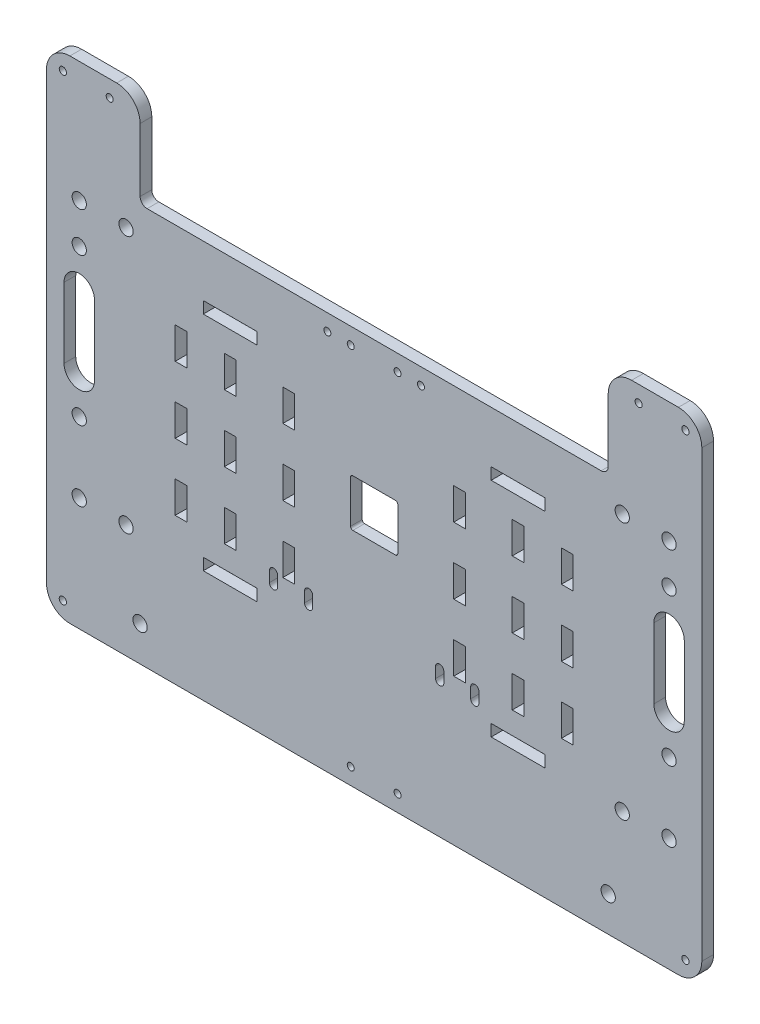
from build123d import *

# Parameters (mm, degrees)
BOSS_EXTRU_1_DEPTH       = 5
ESQUISSE2_W              = 23.01
ESQUISSE2_H              = 5.01
ESQUISSE2_W_2            = 5.01
ESQUISSE2_H_2            = 13.5
ENL_V_MAT_EXTRU_7_DEPTH  = 10
ESQUISSE3_R              = 3.05
ENL_V_MAT_EXTRU_8_DEPTH  = 5
ENL_V_MAT_EXTRU_12_DEPTH = 5
ESQUISSE5_R              = 3.05
ESQUISSE5_R_2            = 1.55
ESQUISSE5_R_3            = 1.5
ENL_V_MAT_EXTRU_13_DEPTH = 5
ENL_V_MAT_EXTRU_14_DEPTH = 5


with BuildPart() as part:
    # Esquisse1 → Boss.-Extru.1 (new body)
    with BuildSketch(Plane.XY):
        with BuildLine():
            Line((130, -105), (-130, -105))
            ThreePointArc((-130, -105), (-137.071067812, -102.071067812), (-140, -95))
            Line((-140, -95), (-140, 105))
            Line((-140, 105), (140, 105))
            Line((140, 105), (140, -95))
            ThreePointArc((140, -95), (137.071067812, -102.071067812), (130, -105))
        make_face()
    extrude(amount=BOSS_EXTRU_1_DEPTH)

    # Esquisse2 → Enlèv. mat.-Extru.7 (cut)
    with BuildSketch(Plane.XY.offset(5)):
        with Locations((-61.505, 40.495)):
            Rectangle(ESQUISSE2_W, ESQUISSE2_H)
        with Locations((-61.505, 21.25)):
            Rectangle(ESQUISSE2_W_2, ESQUISSE2_H_2)
        with Locations((-82.505, 21.25)):
            Rectangle(ESQUISSE2_W_2, ESQUISSE2_H_2)
        with Locations((-82.505, -7.25)):
            Rectangle(ESQUISSE2_W_2, ESQUISSE2_H_2)
        with Locations((-61.505, -7.25)):
            Rectangle(ESQUISSE2_W_2, ESQUISSE2_H_2)
        with Locations((-61.505, -35.75)):
            Rectangle(ESQUISSE2_W_2, ESQUISSE2_H_2)
        with Locations((-82.505, -35.75)):
            Rectangle(ESQUISSE2_W_2, ESQUISSE2_H_2)
        with Locations((-61.505, -54.495)):
            Rectangle(ESQUISSE2_W, ESQUISSE2_H)
        with Locations((-36.505, -35.75)):
            Rectangle(ESQUISSE2_W_2, ESQUISSE2_H_2)
        with Locations((-36.505, 21.25)):
            Rectangle(ESQUISSE2_W_2, ESQUISSE2_H_2)
        with Locations((-36.505, -7.25)):
            Rectangle(ESQUISSE2_W_2, ESQUISSE2_H_2)
        with Locations((36.505, 21.25)):
            Rectangle(ESQUISSE2_W_2, ESQUISSE2_H_2)
        with Locations((61.505, 40.495)):
            Rectangle(ESQUISSE2_W, ESQUISSE2_H)
        with Locations((61.505, 21.25)):
            Rectangle(ESQUISSE2_W_2, ESQUISSE2_H_2)
        with Locations((82.505, 21.25)):
            Rectangle(ESQUISSE2_W_2, ESQUISSE2_H_2)
        with Locations((82.505, -35.75)):
            Rectangle(ESQUISSE2_W_2, ESQUISSE2_H_2)
        with Locations((82.505, -7.25)):
            Rectangle(ESQUISSE2_W_2, ESQUISSE2_H_2)
        with Locations((61.505, -7.25)):
            Rectangle(ESQUISSE2_W_2, ESQUISSE2_H_2)
        with Locations((61.505, -35.75)):
            Rectangle(ESQUISSE2_W_2, ESQUISSE2_H_2)
        with Locations((61.505, -54.495)):
            Rectangle(ESQUISSE2_W, ESQUISSE2_H)
        with Locations((36.505, -35.75)):
            Rectangle(ESQUISSE2_W_2, ESQUISSE2_H_2)
        with Locations((36.505, -7.25)):
            Rectangle(ESQUISSE2_W_2, ESQUISSE2_H_2)
    extrude(amount=-ENL_V_MAT_EXTRU_7_DEPTH, mode=Mode.SUBTRACT)

    # Esquisse3 → Enlèv. mat.-Extru.8 (cut)
    with BuildSketch(Plane.XY.offset(5)):
        with Locations((-126, 36.4987829)):
            Circle(ESQUISSE3_R)
        with Locations((-126, -26.5012171)):
            Circle(ESQUISSE3_R)
        with Locations((-126, 53.4987829)):
            Circle(ESQUISSE3_R)
        with Locations((-126, -56.5012171)):
            Circle(ESQUISSE3_R)
        with Locations((-106, 53.4987829)):
            Circle(ESQUISSE3_R)
        with Locations((-106, -56.5012171)):
            Circle(ESQUISSE3_R)
        with Locations((106, -56.5012171)):
            Circle(ESQUISSE3_R)
        with Locations((106, 53.4987829)):
            Circle(ESQUISSE3_R)
        with Locations((126, -56.5012171)):
            Circle(ESQUISSE3_R)
        with Locations((126, 53.4987829)):
            Circle(ESQUISSE3_R)
        with Locations((126, -26.5012171)):
            Circle(ESQUISSE3_R)
        with Locations((126, 36.4987829)):
            Circle(ESQUISSE3_R)
    extrude(amount=-ENL_V_MAT_EXTRU_8_DEPTH, mode=Mode.SUBTRACT)

    # Esquisse4 → Enlèv. mat.-Extru.12 (cut)
    with BuildSketch(Plane.XY.offset(5)):
        with BuildLine():
            Line((-132.5, 19.9987829), (-132.5, -10.0012171))
            ThreePointArc((-132.5, -10.0012171), (-126, -16.5012171), (-119.5, -10.0012171))
            Line((-119.5, -10.0012171), (-119.5, 19.9987829))
            ThreePointArc((-119.5, 19.9987829), (-126, 26.4987829), (-132.5, 19.9987829))
        make_face()
        with BuildLine():
            Line((140, 95), (140, 105))
            Line((140, 105), (130, 105))
            ThreePointArc((130, 105), (137.071067812, 102.071067812), (140, 95))
        make_face()
        with BuildLine():
            ThreePointArc((-140, 95), (-137.071067812, 102.071067812), (-130, 105))
            Line((-130, 105), (-140, 105))
            Line((-140, 105), (-140, 95))
        make_face()
        with BuildLine():
            ThreePointArc((100, 95), (102.928932188, 102.071067812), (110, 105))
            Line((110, 105), (-110, 105))
            ThreePointArc((-110, 105), (-102.928932188, 102.071067812), (-100, 95))
            Line((-100, 95), (-100, 68))
            ThreePointArc((-100, 68), (-99.121320344, 65.878679656), (-97, 65))
            Line((-97, 65), (97, 65))
            ThreePointArc((97, 65), (99.121320344, 65.878679656), (100, 68))
            Line((100, 68), (100, 95))
        make_face()
        with BuildLine():
            ThreePointArc((119.5, -10.0012171), (126, -16.5012171), (132.5, -10.0012171))
            Line((132.5, -10.0012171), (132.5, 19.9987829))
            ThreePointArc((132.5, 19.9987829), (126, 26.4987829), (119.5, 19.9987829))
            Line((119.5, 19.9987829), (119.5, -10.0012171))
        make_face()
    extrude(amount=-ENL_V_MAT_EXTRU_12_DEPTH, mode=Mode.SUBTRACT)

    # Esquisse5 → Enlèv. mat.-Extru.13 (cut)
    with BuildSketch(Plane.XY.offset(5)):
        with Locations((-100, -90)):
            Circle(ESQUISSE5_R)
        with Locations((-133, -98)):
            Circle(ESQUISSE5_R_2)
        with Locations((-133, 98)):
            Circle(ESQUISSE5_R_2)
        with Locations((133, -98)):
            Circle(ESQUISSE5_R_2)
        with Locations((100, -90)):
            Circle(ESQUISSE5_R)
        with Locations((133, 98)):
            Circle(ESQUISSE5_R_2)
        with Locations((-113, 98)):
            Circle(ESQUISSE5_R_3)
        with Locations((113, 98)):
            Circle(ESQUISSE5_R_3)
        with Locations((-10, -98)):
            Circle(ESQUISSE5_R_3)
        with Locations((10, -98)):
            Circle(ESQUISSE5_R_3)
        with Locations((-20, 58)):
            Circle(ESQUISSE5_R_3)
        with Locations((-10, 58)):
            Circle(ESQUISSE5_R_3)
        with Locations((10, 58)):
            Circle(ESQUISSE5_R_3)
        with Locations((20, 58)):
            Circle(ESQUISSE5_R_3)
        with BuildLine():
            Line((-9.1, 10.1), (9.1, 10.1))
            ThreePointArc((9.1, 10.1), (9.807106781, 9.807106781), (10.1, 9.1))
            Line((10.1, 9.1), (10.1, -9.1))
            ThreePointArc((10.1, -9.1), (9.807106781, -9.807106781), (9.1, -10.1))
            Line((9.1, -10.1), (-9.1, -10.1))
            ThreePointArc((-9.1, -10.1), (-9.807106781, -9.807106781), (-10.1, -9.1))
            Line((-10.1, -9.1), (-10.1, 9.1))
            ThreePointArc((-10.1, 9.1), (-9.807106781, 9.807106781), (-9.1, 10.1))
        make_face()
    extrude(amount=-ENL_V_MAT_EXTRU_13_DEPTH, mode=Mode.SUBTRACT)

    # Esquisse6 → Enlèv. mat.-Extru.14 (cut)
    with BuildSketch(Plane.XY.offset(5)):
        with BuildLine():
            Line((-41.25, -42.75), (-41.25, -47.25))
            ThreePointArc((-41.25, -47.25), (-43, -49), (-44.75, -47.25))
            Line((-44.75, -47.25), (-44.75, -42.75))
            ThreePointArc((-44.75, -42.75), (-43, -41), (-41.25, -42.75))
        make_face()
        with BuildLine():
            Line((-26.25, -42.75), (-26.25, -47.25))
            ThreePointArc((-26.25, -47.25), (-28, -49), (-29.75, -47.25))
            Line((-29.75, -47.25), (-29.75, -42.75))
            ThreePointArc((-29.75, -42.75), (-28, -41), (-26.25, -42.75))
        make_face()
        with BuildLine():
            Line((26.25, -42.75), (26.25, -47.25))
            ThreePointArc((26.25, -47.25), (28, -49), (29.75, -47.25))
            Line((29.75, -47.25), (29.75, -42.75))
            ThreePointArc((29.75, -42.75), (28, -41), (26.25, -42.75))
        make_face()
        with BuildLine():
            Line((41.25, -42.75), (41.25, -47.25))
            ThreePointArc((41.25, -47.25), (43, -49), (44.75, -47.25))
            Line((44.75, -47.25), (44.75, -42.75))
            ThreePointArc((44.75, -42.75), (43, -41), (41.25, -42.75))
        make_face()
    extrude(amount=-ENL_V_MAT_EXTRU_14_DEPTH, mode=Mode.SUBTRACT)


solid = part.part
